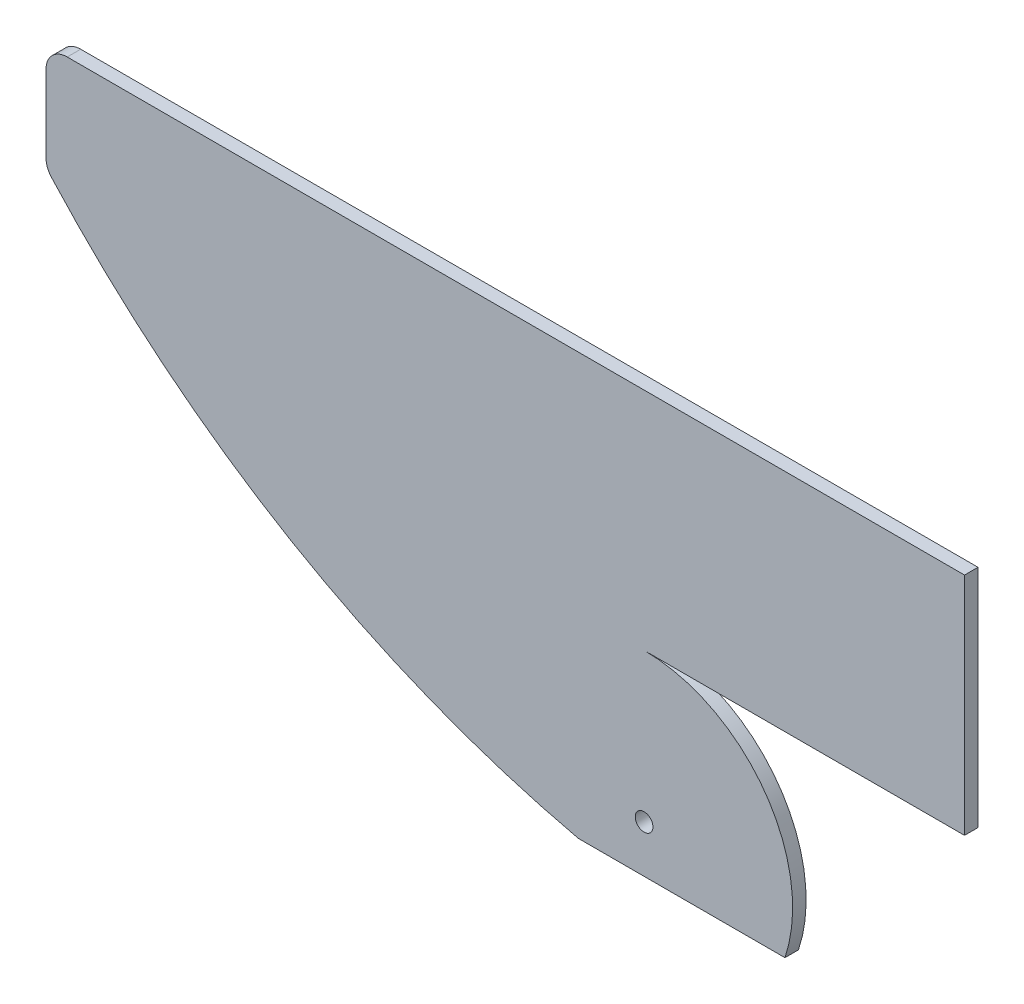
from build123d import *

# Parameters (mm, degrees)
CROQUIS1_W              = 62
CROQUIS1_H              = 44.45
CROQUIS1_R              = 4.168993309
SALIENTE_EXTRUIR1_DEPTH = 6.35
CORTAR_EXTRUIR1_DEPTH   = 6.35
CROQUIS4_W              = 501.85323645
CROQUIS4_H              = 287.183942178
CORTAR_EXTRUIR2_DEPTH   = 6.35


with BuildPart() as part:
    # Croquis1 → Saliente-Extruir1 (new body)
    # profile 1 of 2: a face of its own
    with BuildSketch(Plane.XY):
        with BuildLine():
            Line((31, 22.225), (31, -22.225))
            Line((31, -22.225), (333, -22.225))
            ThreePointArc((333, -22.225), (468.296416477, 31.525514455), (581.256141711, 123.364169664))
            ThreePointArc((581.256141711, 123.364169664), (583.174687818, 126.479763895), (583.844075147, 130.076938784))
            Line((583.844075147, 130.076938784), (583.844075147, 166.244969995))
            ThreePointArc((583.844075147, 166.244969995), (580.915142959, 173.316037807), (573.844075147, 176.244969995))
            Line((573.844075147, 176.244969995), (-271.844075147, 176.244969995))
            ThreePointArc((-271.844075147, 176.244969995), (-278.915142959, 173.316037807), (-281.844075147, 166.244969995))
            Line((-281.844075147, 166.244969995), (-281.844075147, 130.076938784))
            ThreePointArc((-281.844075147, 130.076938784), (-281.174687818, 126.479763895), (-279.256141711, 123.364169664))
            ThreePointArc((-279.256141711, 123.364169664), (-166.296416477, 31.525514455), (-31, -22.225))
            Line((-31, -22.225), (-31, 22.225))
            Line((-31, 22.225), (31, 22.225))
        make_face()
    # profile 2 of 2: a face of its own
    with BuildSketch(Plane.XY):
        Rectangle(CROQUIS1_W, CROQUIS1_H)
        Circle(CROQUIS1_R, mode=Mode.SUBTRACT)
    extrude(amount=SALIENTE_EXTRUIR1_DEPTH)

    # Croquis3 → Cortar-Extruir1 (cut)
    with BuildSketch(Plane.XY.offset(6.35)):
        with BuildLine():
            Line((151, -22.225), (151, 70))
            Line((151, 70), (0, 70))
            ThreePointArc((0, 70), (56.814390783, 40.891625059), (66.378079025, -22.225))
            Line((66.378079025, -22.225), (151, -22.225))
        make_face()
        with BuildLine():
            Line((302, 70), (151, 70))
            Line((151, 70), (151, -22.225))
            Line((151, -22.225), (235.621920975, -22.225))
            ThreePointArc((235.621920975, -22.225), (245.185609217, 40.891625059), (302, 70))
        make_face()
    extrude(amount=-CORTAR_EXTRUIR1_DEPTH, mode=Mode.SUBTRACT)

    # Croquis4 → Cortar-Extruir2 (cut)
    with BuildSketch(Plane.XY.offset(6.35)):
        with Locations((401.926618225, 32.652998906)):
            Rectangle(CROQUIS4_W, CROQUIS4_H)
    extrude(amount=-CORTAR_EXTRUIR2_DEPTH, mode=Mode.SUBTRACT)


solid = part.part
